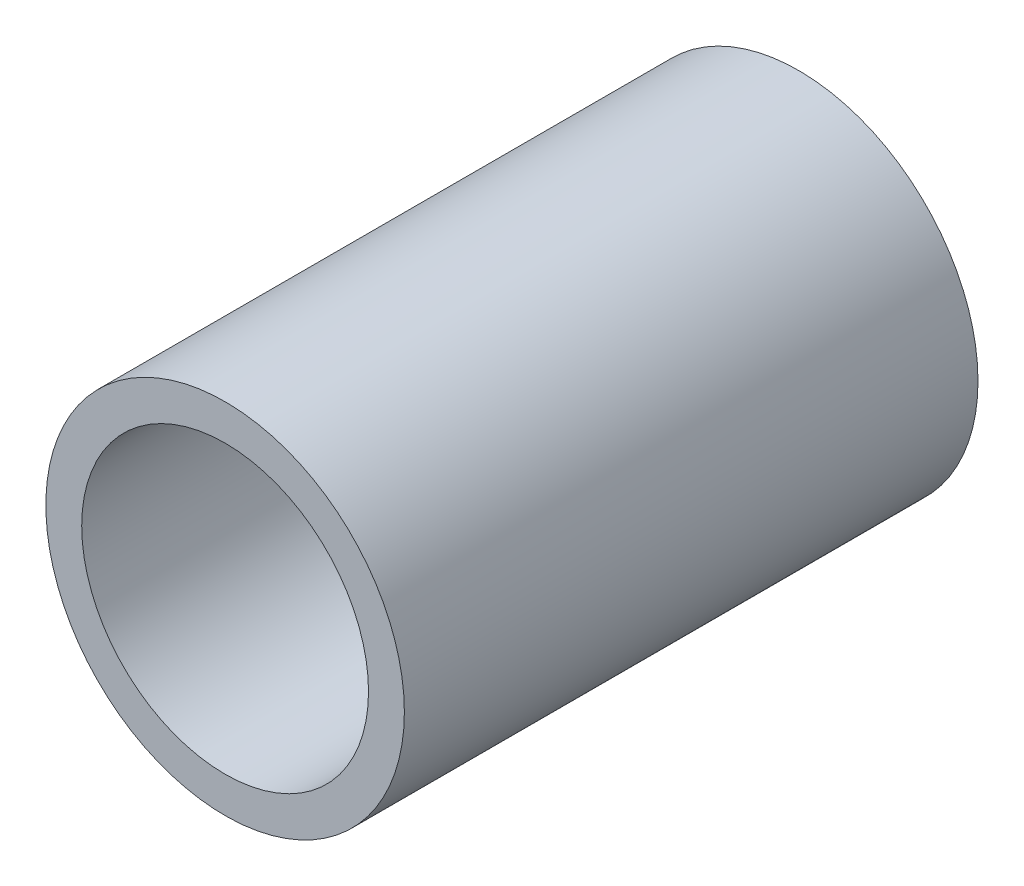
from build123d import *

# Parameters (mm, degrees)
SKETCH1_R      = 3.96875
SKETCH1_R_2    = 3.175
EXTRUDE1_DEPTH = 6.35


with BuildPart() as part:
    # Sketch1 → Extrude1 (new, symmetric)
    with BuildSketch(Plane.XY):
        Circle(SKETCH1_R)
        Circle(SKETCH1_R_2, mode=Mode.SUBTRACT)
    extrude(amount=EXTRUDE1_DEPTH, both=True)


solid = part.part
